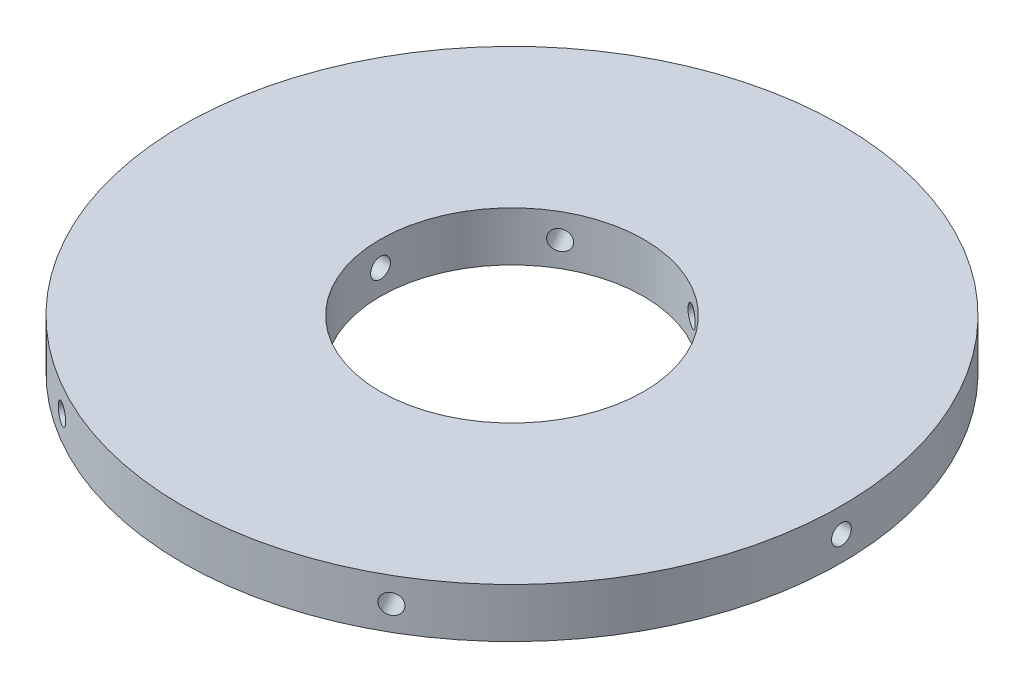
from build123d import *

# Parameters (mm, degrees)
SKETCH1_R           = 100
SKETCH1_R_2         = 40
BOSS_EXTRUDE1_DEPTH = 15
SKETCH2_R           = 3
CUT_EXTRUDE1_DEPTH  = 143.214626533
CIRPATTERN1_COUNT   = 6


with BuildPart() as part:
    # Sketch1 → Boss-Extrude1 (new body)
    with BuildSketch(Plane(origin=(0, 0, 0), x_dir=(1, 0, 0), z_dir=(0, 1, 0))):
        with Locations(Location((0, 0, 0), (0, 0, 270))):
            Circle(SKETCH1_R)
        with Locations(Location((0, 0, 0), (0, 0, 270))):
            Circle(SKETCH1_R_2, mode=Mode.SUBTRACT)
    extrude(amount=BOSS_EXTRUDE1_DEPTH)

    # Sketch2 → Cut-Extrude1 (cut, through all)
    with BuildSketch(Plane(origin=(0, 0, 0), x_dir=(0, 0, -1), z_dir=(1, 0, 0))):
        with Locations((0, 7.5)):
            Circle(SKETCH2_R)
    cut_extrude1 = extrude(amount=-CUT_EXTRUDE1_DEPTH, mode=Mode.SUBTRACT)

    # CirPattern1: Cut-Extrude1 ×6 about axis
    cirpattern1_axis = Axis((0, 15, 0), (0, 1, 0))
    for i in range(1, CIRPATTERN1_COUNT):
        add(cut_extrude1.rotate(cirpattern1_axis, i * 360 / CIRPATTERN1_COUNT), mode=Mode.SUBTRACT)


solid = part.part
